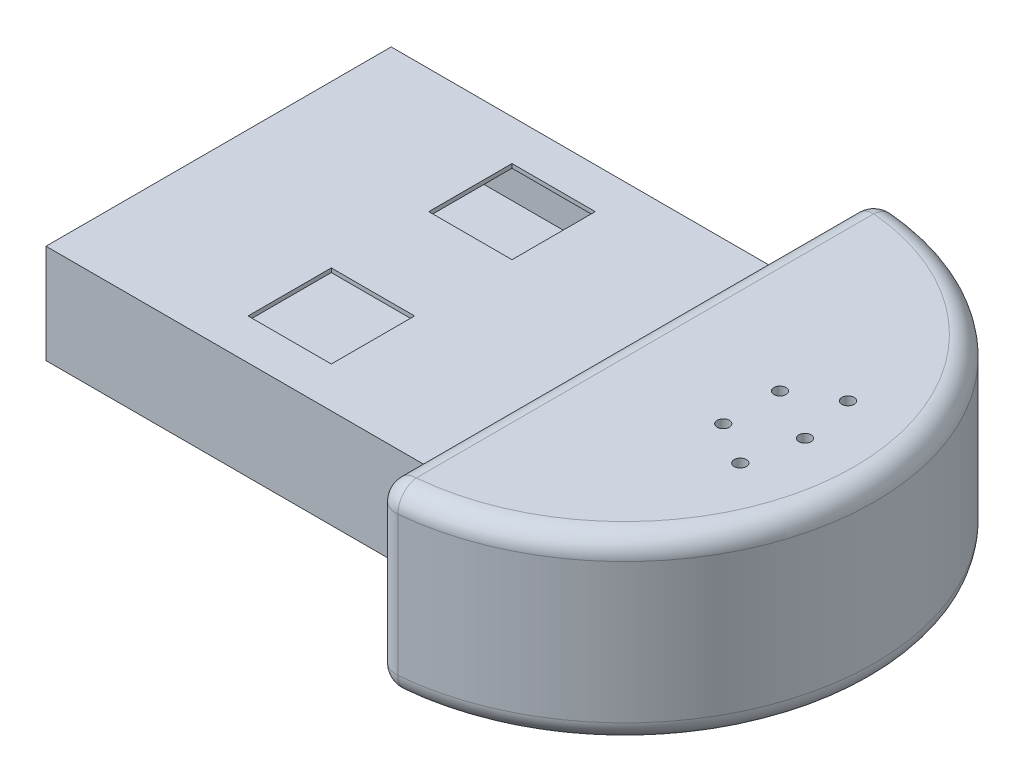
from build123d import *

# Parameters (mm, degrees)
BOSS_EXTRUDE1_DEPTH = 2.44
BOSS_EXTRUDE2_DEPTH = 1
BOSS_EXTRUDE3_START = 1
BOSS_EXTRUDE3_DEPTH = 1
SKETCH4_W           = 8.3
SKETCH4_H           = 1.59
CUT_EXTRUDE1_DEPTH  = 10
FILLET1_R           = 0.5
SKETCH5_R           = 0.15
CUT_EXTRUDE2_DEPTH  = 0.5
SKETCH6_W           = 2.05
SKETCH6_H           = 2.05
CUT_EXTRUDE3_DEPTH  = 0.5


with BuildPart() as part:
    # Sketch1 → Boss-Extrude1 (new body)
    with BuildSketch(Plane(origin=(0, 0, 0), x_dir=(1, 0, 0), z_dir=(0, 1, 0))):
        with BuildLine():
            Line((5, 6.154307787), (5, 4.25))
            Line((5, 4.25), (-5, 4.25))
            Line((-5, 4.25), (-5, -4.25))
            Line((-5, -4.25), (5, -4.25))
            Line((5, -4.25), (5, -6.154307787))
            ThreePointArc((5, -6.154307787), (11.154307787, 0), (5, 6.154307787))
        make_face()
    extrude(amount=BOSS_EXTRUDE1_DEPTH)

    # Sketch2 → Boss-Extrude2 (add)
    with BuildSketch(Plane(origin=(0, 2.44, 0), x_dir=(1, 0, 0), z_dir=(0, 1, 0))):
        with BuildLine():
            Line((5, 6.154307787), (5, -6.154307787))
            ThreePointArc((5, -6.154307787), (11.154307787, 0), (5, 6.154307787))
        make_face()
    extrude(amount=BOSS_EXTRUDE2_DEPTH)

    # Sketch3 → Boss-Extrude3 (add)
    with BuildSketch(Plane.XZ.offset(BOSS_EXTRUDE3_START)):
        with BuildLine():
            Line((5, 6.154307787), (5, -6.154307787))
            ThreePointArc((5, -6.154307787), (11.154307787, 0), (5, 6.154307787))
        make_face()
    extrude(amount=-BOSS_EXTRUDE3_DEPTH)

    # Sketch4 → Cut-Extrude1 (cut)
    with BuildSketch(Plane.ZY.offset(5)):
        with Locations((0, 1.545)):
            Rectangle(SKETCH4_W, SKETCH4_H)
    extrude(amount=-CUT_EXTRUDE1_DEPTH, mode=Mode.SUBTRACT)

    # Fillet1
    fillet1_edges = [part.edges().sort_by_distance(p)[0] for p in [
        (5, 1.22, -6.154307787),
        (5, 1.22, 6.154307787),
        (11.154307787, 3.44, 0),
        (5, 3.44, 0),
        (11.154307787, -1, 0),
        (5, -1, 0),
    ]]
    fillet(fillet1_edges, radius=FILLET1_R)

    # Sketch5 → Cut-Extrude2 (cut)
    with BuildSketch(Plane(origin=(0, 3.44, 0), x_dir=(1, 0, 0), z_dir=(0, 1, 0))):
        with Locations(Location((9.172175781, 1.326041416, 0), (0, 0, 270))):
            Circle(SKETCH5_R)
        with Locations(Location((8.125504079, 0.698038394, 0), (0, 0, 270))):
            Circle(SKETCH5_R)
        with Locations(Location((9.439658549, 0, 0), (0, 0, 270))):
            Circle(SKETCH5_R)
        with Locations(Location((9.172175781, -1.326041416, 0), (0, 0, 90))):
            Circle(SKETCH5_R)
        with Locations(Location((8.125504079, -0.698038394, 0), (0, 0, 90))):
            Circle(SKETCH5_R)
    extrude(amount=-CUT_EXTRUDE2_DEPTH, mode=Mode.SUBTRACT)

    # Sketch6 → Cut-Extrude3 (cut)
    with BuildSketch(Plane(origin=(0, 2.44, 0), x_dir=(1, 0, 0), z_dir=(0, 1, 0))):
        with Locations((0, -2.225)):
            Rectangle(SKETCH6_W, SKETCH6_H)
        with Locations((0, 2.225)):
            Rectangle(SKETCH6_W, SKETCH6_H)
    extrude(amount=-CUT_EXTRUDE3_DEPTH, mode=Mode.SUBTRACT)


solid = part.part
